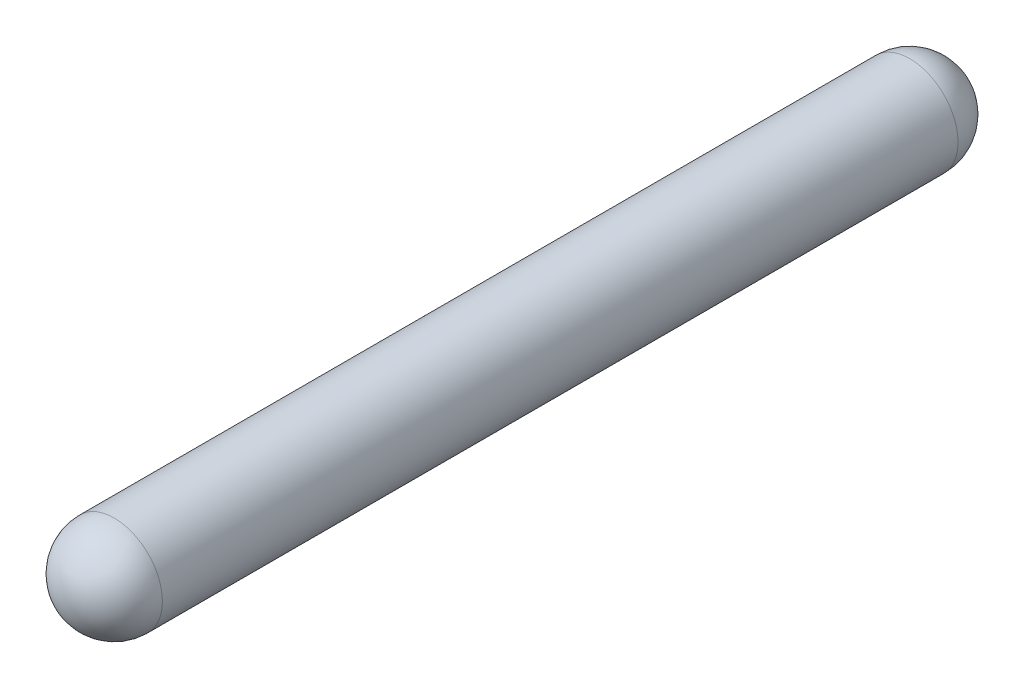
from build123d import *


with BuildPart() as part:
    # Sketch1 → Revolve1 (revolve)
    with BuildSketch(Plane.XZ, mode=Mode.PRIVATE) as revolve1_sk:
        with BuildLine():
            Line((0, 18.5), (0, -18.5))
            ThreePointArc((0, -18.5), (1.414213562, -17.914213562), (2, -16.5))
            Line((2, -16.5), (2, 16.5))
            ThreePointArc((2, 16.5), (1.414213562, 17.914213562), (0, 18.5))
        make_face()
    revolve(revolve1_sk.sketch.rotate(Axis((0, 0, 18.5), (0, 0, -1)), 180), axis=Axis((0, 0, 18.5), (0, 0, -1)))


solid = part.part
